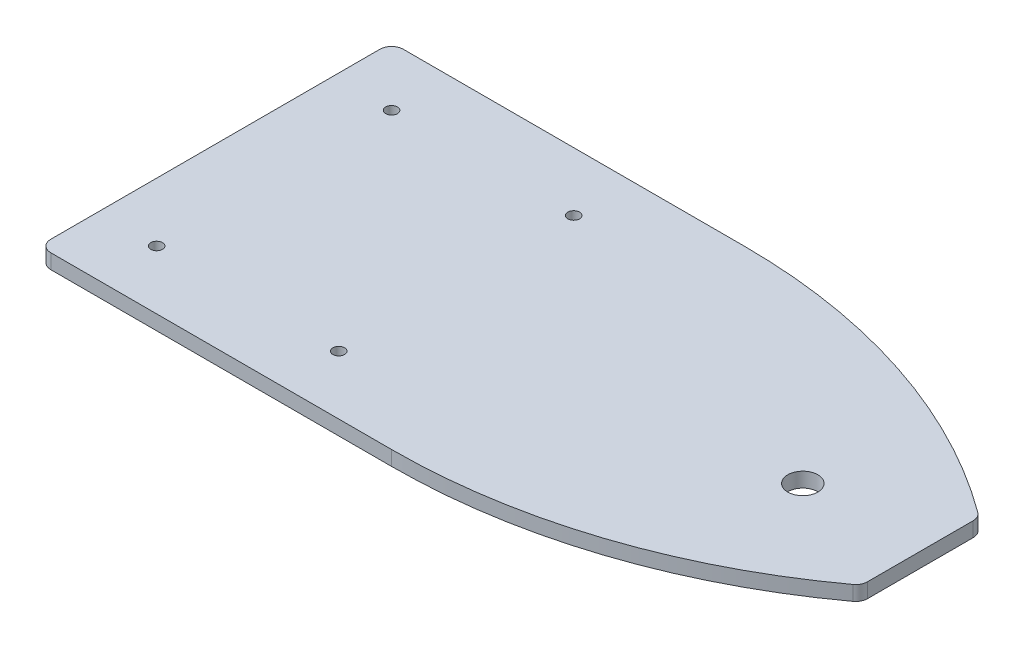
from build123d import *

# Parameters (mm, degrees)
SKETCH1_W           = 152.4
SKETCH1_H           = 76.2
BOSS_EXTRUDE1_DEPTH = 3.175
CUT_EXTRUDE1_DEPTH  = 3.175
FILLET2_R           = 2.54
FILLET3_R           = 2.54
SKETCH5_R           = 7.62
CUT_EXTRUDE2_DEPTH  = 3.175
SKETCH6_R           = 1.27
CUT_EXTRUDE3_DEPTH  = 3.175
BOSS_EXTRUDE2_START = -3.175
SKETCH7_R           = 7.62
SKETCH7_R_2         = 3.25
BOSS_EXTRUDE2_DEPTH = 3.175


with BuildPart() as part:
    # Sketch1 → Boss-Extrude1 (new body)
    with BuildSketch(Plane(origin=(0, 0, 0), x_dir=(1, 0, 0), z_dir=(0, 1, 0))):
        Rectangle(SKETCH1_W, SKETCH1_H)
    extrude(amount=BOSS_EXTRUDE1_DEPTH)

    # Sketch4 → Cut-Extrude1 (cut)
    with BuildSketch(Plane(origin=(0, 3.175, 0), x_dir=(1, 0, 0), z_dir=(0, 1, 0))):
        with BuildLine():
            Line((0, 38.1), (76.2, 38.1))
            Line((76.2, 38.1), (76.2, 12.7))
            ThreePointArc((76.2, 12.7), (40.160926284, 31.582778852), (0, 38.1))
        make_face()
        with BuildLine():
            Line((76.2, -38.1), (76.2, -12.7))
            ThreePointArc((76.2, -12.7), (40.160926284, -31.582778852), (0, -38.1))
            Line((0, -38.1), (76.2, -38.1))
        make_face()
    extrude(amount=-CUT_EXTRUDE1_DEPTH, mode=Mode.SUBTRACT)

    # Fillet2
    fillet2_edges = [part.edges().sort_by_distance(p)[0] for p in [
        (76.2, 1.5875, -12.7),
        (76.2, 1.5875, 12.7),
    ]]
    fillet(fillet2_edges, radius=FILLET2_R)

    # Fillet3
    fillet3_edges = [part.edges().sort_by_distance(p)[0] for p in [
        (-76.2, 1.5875, -38.1),
        (-76.2, 1.5875, 38.1),
    ]]
    fillet(fillet3_edges, radius=FILLET3_R)

    # Sketch5 → Cut-Extrude2 (cut)
    with BuildSketch(Plane(origin=(0, 3.175, 0), x_dir=(1, 0, 0), z_dir=(0, 1, 0))):
        with Locations(Location((50.8, 0, 0), (0, 0, 270))):
            Circle(SKETCH5_R)
    extrude(amount=-CUT_EXTRUDE2_DEPTH, mode=Mode.SUBTRACT)

    # Sketch6 → Cut-Extrude3 (cut)
    with BuildSketch(Plane(origin=(0, 3.175, 0), x_dir=(1, 0, 0), z_dir=(0, 1, 0))):
        with Locations(Location((-63.5, 25.4, 0), (0, 0, 270))):
            Circle(SKETCH6_R)
        with Locations(Location((-63.5, -25.4, 0), (0, 0, 270))):
            Circle(SKETCH6_R)
        with Locations(Location((-24.13, 25.4, 0), (0, 0, 270))):
            Circle(SKETCH6_R)
        with Locations(Location((-24.13, -25.4, 0), (0, 0, 270))):
            Circle(SKETCH6_R)
    extrude(amount=-CUT_EXTRUDE3_DEPTH, mode=Mode.SUBTRACT)

    # Sketch7 → Boss-Extrude2 (add)
    with BuildSketch(Plane.XZ.offset(BOSS_EXTRUDE2_START)):
        with Locations((50.8, 0)):
            Circle(SKETCH7_R)
        with Locations(Location((50.8, 0, 0), (0, 0, 270))):
            Circle(SKETCH7_R_2, mode=Mode.SUBTRACT)
    extrude(amount=BOSS_EXTRUDE2_DEPTH)


solid = part.part
